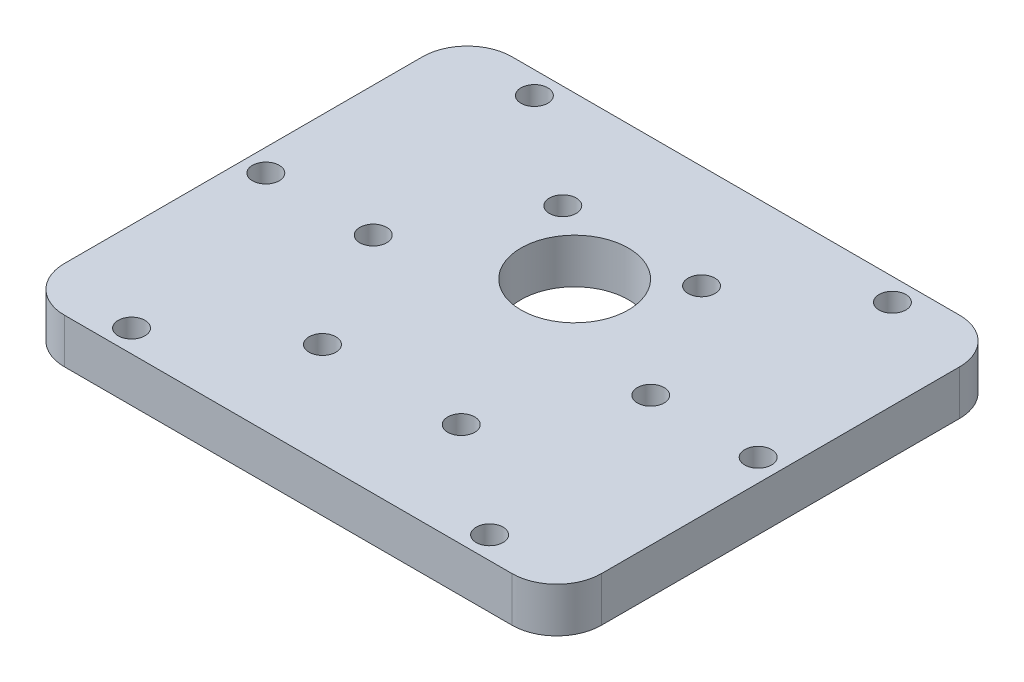
from build123d import *

# Parameters (mm, degrees)
SKETCH1_W           = 60
SKETCH1_H           = 50
BOSS_EXTRUDE1_DEPTH = 5
SKETCH2_R           = 6
SKETCH2_R_2         = 1.5
CUT_EXTRUDE1_DEPTH  = 5
FILLET1_R           = 5


with BuildPart() as part:
    # Sketch1 → Boss-Extrude1 (new body)
    with BuildSketch(Plane(origin=(0, 0, 0), x_dir=(1, 0, 0), z_dir=(0, 1, 0))):
        Rectangle(SKETCH1_W, SKETCH1_H)
    extrude(amount=BOSS_EXTRUDE1_DEPTH)

    # Sketch2 → Cut-Extrude1 (cut)
    with BuildSketch(Plane(origin=(0, 5, 0), x_dir=(1, 0, 0), z_dir=(0, 1, 0))):
        with Locations(Location((0, 7, 0), (0, 0, 270))):
            Circle(SKETCH2_R)
        with Locations(Location((-7.75, 13.423393759, 0), (0, 0, 270))):
            Circle(SKETCH2_R_2)
        with Locations(Location((-15.5, 0, 0), (0, 0, 270))):
            Circle(SKETCH2_R_2)
        with Locations(Location((-7.75, -13.423393759, 0), (0, 0, 270))):
            Circle(SKETCH2_R_2)
        with Locations(Location((7.75, -13.423393759, 0), (0, 0, 270))):
            Circle(SKETCH2_R_2)
        with Locations(Location((15.5, 0, 0), (0, 0, 270))):
            Circle(SKETCH2_R_2)
        with Locations(Location((7.75, 13.423393759, 0), (0, 0, 270))):
            Circle(SKETCH2_R_2)
        with Locations(Location((-20, 22.5, 0), (0, 0, 270))):
            Circle(SKETCH2_R_2)
        with Locations(Location((20, 22.5, 0), (0, 0, 270))):
            Circle(SKETCH2_R_2)
        with Locations(Location((20, -22.5, 0), (0, 0, 270))):
            Circle(SKETCH2_R_2)
        with Locations(Location((-20, -22.5, 0), (0, 0, 270))):
            Circle(SKETCH2_R_2)
        with Locations(Location((-27.5, 0, 0), (0, 0, 270))):
            Circle(SKETCH2_R_2)
        with Locations(Location((27.5, 0, 0), (0, 0, 270))):
            Circle(SKETCH2_R_2)
    extrude(amount=-CUT_EXTRUDE1_DEPTH, mode=Mode.SUBTRACT)

    # Fillet1
    fillet1_edges = [part.edges().sort_by_distance(p)[0] for p in [
        (30, 2.5, 25),
        (-30, 2.5, 25),
        (-30, 2.5, -25),
        (30, 2.5, -25),
    ]]
    fillet(fillet1_edges, radius=FILLET1_R)


solid = part.part
